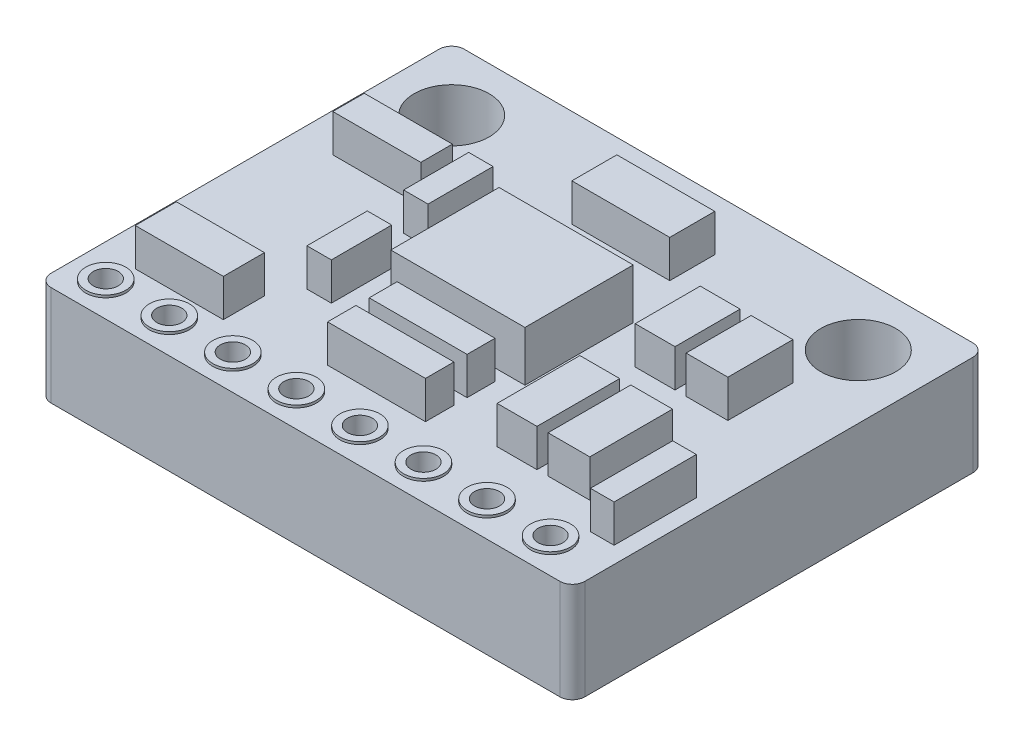
from build123d import *

# Parameters (mm, degrees)
ESBO_O3_W                         = 21.336
ESBO_O3_H                         = 16.51
RESSALTO_EXTRUS_O2_DEPTH          = 4
ESBO_O4_R                         = 1.5
CORTE_EXTRUS_O1_DEPTH             = 4
FILETE1_R                         = 0.5
FILETE2_R                         = 0.5
FILETE3_R                         = 0.5
FILETE4_R                         = 0.5
ESBO_O6_W                         = 5.363320094
ESBO_O6_H                         = 4.328965504
RESSALTO_EXTRUS_O3_DEPTH          = 2
ESBO_O7_W                         = 3.520843833
ESBO_O7_H                         = 1.644177383
ESBO_O7_H_2                       = 1.26172738
ESBO_O7_W_2                       = 3.914121278
ESBO_O7_H_3                       = 1.80047819
ESBO_O7_W_3                       = 1.591796621
ESBO_O7_H_4                       = 2.601533146
ESBO_O7_W_4                       = 1.669839356
ESBO_O7_H_5                       = 3.308391078
ESBO_O7_W_5                       = 0.945688299
ESBO_O7_H_6                       = 3.288354766
ESBO_O7_W_6                       = 0.976018527
ESBO_O7_H_7                       = 2.412779016
ESBO_O7_H_8                       = 1.116603467
ESBO_O7_H_9                       = 1.136639779
RESSALTO_EXTRUS_O4_DEPTH          = 1.5
ESBO_O8_R                         = 0.8
RESSALTO_EXTRUS_O5_DEPTH          = 0.1
CORTE_EXTRUS_O2_REACH             = 16.07
ESBO_O9_R                         = 0.5
CORTE_EXTRUS_O2_DIRECTION_2_REACH = 16.07


with BuildPart() as part:
    # Esboço3 → Ressalto-extrusão2 (new body)
    with BuildSketch(Plane(origin=(0, 0, 0), x_dir=(1, 0, 0), z_dir=(0, 1, 0))):
        Rectangle(ESBO_O3_W, ESBO_O3_H)
    extrude(amount=RESSALTO_EXTRUS_O2_DEPTH)

    # Esboço4 → Corte-extrusão1 (cut)
    with BuildSketch(Plane(origin=(0, 4, 0), x_dir=(1, 0, 0), z_dir=(0, 1, 0))):
        with Locations(Location((-8.128, 5.715, 0), (0, 0, 270))):
            Circle(ESBO_O4_R)
        with Locations(Location((8.128, 5.715, 0), (0, 0, 270))):
            Circle(ESBO_O4_R)
    extrude(amount=-CORTE_EXTRUS_O1_DEPTH, mode=Mode.SUBTRACT)

    # Filete1
    filete1_edges = [part.edges().sort_by_distance(p)[0] for p in [
        (-10.668, 2, -8.255),
    ]]
    fillet(filete1_edges, radius=FILETE1_R)

    # Filete2
    filete2_edges = [part.edges().sort_by_distance(p)[0] for p in [
        (10.668, 2, -8.255),
    ]]
    fillet(filete2_edges, radius=FILETE2_R)

    # Filete3
    filete3_edges = [part.edges().sort_by_distance(p)[0] for p in [
        (-10.668, 2, 8.255),
    ]]
    fillet(filete3_edges, radius=FILETE3_R)

    # Filete4
    filete4_edges = [part.edges().sort_by_distance(p)[0] for p in [
        (10.668, 2, 8.255),
    ]]
    fillet(filete4_edges, radius=FILETE4_R)

    # Esboço6 → Ressalto-extrusão3 (add)
    with BuildSketch(Plane(origin=(0, 4, 0), x_dir=(1, 0, 0), z_dir=(0, 1, 0))):
        Rectangle(ESBO_O6_W, ESBO_O6_H)
    extrude(amount=RESSALTO_EXTRUS_O3_DEPTH)

    # Esboço7 → Ressalto-extrusão4 (add)
    with BuildSketch(Plane(origin=(0, 4, 0), x_dir=(1, 0, 0), z_dir=(0, 1, 0))):
        with Locations((-7.375825986, -5.101929154)):
            Rectangle(ESBO_O7_W, ESBO_O7_H)
        with Locations((-7.375825986, 2.601618051)):
            Rectangle(ESBO_O7_W, ESBO_O7_H_2)
        with Locations((0, 5.249162988)):
            Rectangle(ESBO_O7_W_2, ESBO_O7_H_3)
        with Locations((5.049892828, 1.970754361)):
            Rectangle(ESBO_O7_W_3, ESBO_O7_H_4)
        with Locations((7.123709081, 1.970754361)):
            Rectangle(ESBO_O7_W_4, ESBO_O7_H_4)
        with Locations((5.049892828, -3.193964812)):
            Rectangle(ESBO_O7_W_3, ESBO_O7_H_5)
        with Locations((7.123709081, -3.193964812)):
            Rectangle(ESBO_O7_W_4, ESBO_O7_H_5)
        with Locations((9.532074416, -4.279840462)):
            Rectangle(ESBO_O7_W_5, ESBO_O7_H_6)
        with Locations((-4.515338041, 1.970754361)):
            Rectangle(ESBO_O7_W_6, ESBO_O7_H_4)
        with Locations((-4.515338041, -1.987575304)):
            Rectangle(ESBO_O7_W_6, ESBO_O7_H_7)
        with Locations((0, -3.193964812)):
            Rectangle(ESBO_O7_W_2, ESBO_O7_H_8)
        with Locations((0, -4.848160352)):
            Rectangle(ESBO_O7_W_2, ESBO_O7_H_9)
    extrude(amount=RESSALTO_EXTRUS_O4_DEPTH)

    # Esboço8 → Ressalto-extrusão5 (add)
    with BuildSketch(Plane(origin=(0, 4, 0), x_dir=(1, 0, 0), z_dir=(0, 1, 0))):
        with Locations(Location((-9.285722554, -6.953840931, 0), (0, 0, 270))):
            Circle(ESBO_O8_R)
        with Locations(Location((-6.745722554, -6.953840931, 0), (0, 0, 270))):
            Circle(ESBO_O8_R)
        with Locations(Location((-4.205722554, -6.953840931, 0), (0, 0, 270))):
            Circle(ESBO_O8_R)
        with Locations(Location((-1.665722554, -6.953840931, 0), (0, 0, 270))):
            Circle(ESBO_O8_R)
        with Locations(Location((0.874277446, -6.953840931, 0), (0, 0, 270))):
            Circle(ESBO_O8_R)
        with Locations(Location((3.414277446, -6.953840931, 0), (0, 0, 270))):
            Circle(ESBO_O8_R)
        with Locations(Location((5.954277446, -6.953840931, 0), (0, 0, 270))):
            Circle(ESBO_O8_R)
        with Locations(Location((8.494277446, -6.953840931, 0), (0, 0, 270))):
            Circle(ESBO_O8_R)
    extrude(amount=RESSALTO_EXTRUS_O5_DEPTH)

    # Esboço9 → Corte-extrusão2 (cut, up to next)
    with BuildSketch(Plane(origin=(0, 4, 0), x_dir=(1, 0, 0), z_dir=(0, 1, 0)), mode=Mode.PRIVATE) as corte_extrus_o2_sk1:
        with Locations(Location((-9.285722554, -6.953840931, 0), (0, 0, 270))):
            Circle(ESBO_O9_R)
    corte_extrus_o2_tool1 = extrude(corte_extrus_o2_sk1.sketch, amount=-CORTE_EXTRUS_O2_REACH, mode=Mode.PRIVATE) & part.part
    # Esboço9 → Corte-extrusão2 (cut, up to next)
    with BuildSketch(Plane(origin=(0, 4, 0), x_dir=(1, 0, 0), z_dir=(0, 1, 0)), mode=Mode.PRIVATE) as corte_extrus_o2_sk2:
        with Locations(Location((-6.745722554, -6.953840931, 0), (0, 0, 270))):
            Circle(ESBO_O9_R)
    corte_extrus_o2_tool2 = extrude(corte_extrus_o2_sk2.sketch, amount=-CORTE_EXTRUS_O2_REACH, mode=Mode.PRIVATE) & part.part
    # Esboço9 → Corte-extrusão2 (cut, up to next)
    with BuildSketch(Plane(origin=(0, 4, 0), x_dir=(1, 0, 0), z_dir=(0, 1, 0)), mode=Mode.PRIVATE) as corte_extrus_o2_sk3:
        with Locations(Location((-4.205722554, -6.953840931, 0), (0, 0, 270))):
            Circle(ESBO_O9_R)
    corte_extrus_o2_tool3 = extrude(corte_extrus_o2_sk3.sketch, amount=-CORTE_EXTRUS_O2_REACH, mode=Mode.PRIVATE) & part.part
    # Esboço9 → Corte-extrusão2 (cut, up to next)
    with BuildSketch(Plane(origin=(0, 4, 0), x_dir=(1, 0, 0), z_dir=(0, 1, 0)), mode=Mode.PRIVATE) as corte_extrus_o2_sk4:
        with Locations(Location((-1.665722554, -6.953840931, 0), (0, 0, 270))):
            Circle(ESBO_O9_R)
    corte_extrus_o2_tool4 = extrude(corte_extrus_o2_sk4.sketch, amount=-CORTE_EXTRUS_O2_REACH, mode=Mode.PRIVATE) & part.part
    # Esboço9 → Corte-extrusão2 (cut, up to next)
    with BuildSketch(Plane(origin=(0, 4, 0), x_dir=(1, 0, 0), z_dir=(0, 1, 0)), mode=Mode.PRIVATE) as corte_extrus_o2_sk5:
        with Locations(Location((0.874277446, -6.953840931, 0), (0, 0, 270))):
            Circle(ESBO_O9_R)
    corte_extrus_o2_tool5 = extrude(corte_extrus_o2_sk5.sketch, amount=-CORTE_EXTRUS_O2_REACH, mode=Mode.PRIVATE) & part.part
    # Esboço9 → Corte-extrusão2 (cut, up to next)
    with BuildSketch(Plane(origin=(0, 4, 0), x_dir=(1, 0, 0), z_dir=(0, 1, 0)), mode=Mode.PRIVATE) as corte_extrus_o2_sk6:
        with Locations(Location((3.414277446, -6.953840931, 0), (0, 0, 270))):
            Circle(ESBO_O9_R)
    corte_extrus_o2_tool6 = extrude(corte_extrus_o2_sk6.sketch, amount=-CORTE_EXTRUS_O2_REACH, mode=Mode.PRIVATE) & part.part
    # Esboço9 → Corte-extrusão2 (cut, up to next)
    with BuildSketch(Plane(origin=(0, 4, 0), x_dir=(1, 0, 0), z_dir=(0, 1, 0)), mode=Mode.PRIVATE) as corte_extrus_o2_sk7:
        with Locations(Location((5.954277446, -6.953840931, 0), (0, 0, 270))):
            Circle(ESBO_O9_R)
    corte_extrus_o2_tool7 = extrude(corte_extrus_o2_sk7.sketch, amount=-CORTE_EXTRUS_O2_REACH, mode=Mode.PRIVATE) & part.part
    # Esboço9 → Corte-extrusão2 (cut, up to next)
    with BuildSketch(Plane(origin=(0, 4, 0), x_dir=(1, 0, 0), z_dir=(0, 1, 0)), mode=Mode.PRIVATE) as corte_extrus_o2_sk8:
        with Locations(Location((8.494277446, -6.953840931, 0), (0, 0, 270))):
            Circle(ESBO_O9_R)
    corte_extrus_o2_tool8 = extrude(corte_extrus_o2_sk8.sketch, amount=-CORTE_EXTRUS_O2_REACH, mode=Mode.PRIVATE) & part.part
    add(corte_extrus_o2_tool1.solids().sort_by_distance((-9.285723, 4, 6.953841))[0], mode=Mode.SUBTRACT)
    add(corte_extrus_o2_tool2.solids().sort_by_distance((-6.745723, 4, 6.953841))[0], mode=Mode.SUBTRACT)
    add(corte_extrus_o2_tool3.solids().sort_by_distance((-4.205723, 4, 6.953841))[0], mode=Mode.SUBTRACT)
    add(corte_extrus_o2_tool4.solids().sort_by_distance((-1.665723, 4, 6.953841))[0], mode=Mode.SUBTRACT)
    add(corte_extrus_o2_tool5.solids().sort_by_distance((0.874277, 4, 6.953841))[0], mode=Mode.SUBTRACT)
    add(corte_extrus_o2_tool6.solids().sort_by_distance((3.414277, 4, 6.953841))[0], mode=Mode.SUBTRACT)
    add(corte_extrus_o2_tool7.solids().sort_by_distance((5.954277, 4, 6.953841))[0], mode=Mode.SUBTRACT)
    add(corte_extrus_o2_tool8.solids().sort_by_distance((8.494277, 4, 6.953841))[0], mode=Mode.SUBTRACT)

    # Esboço9 → Corte-extrusão2 direction 2 (cut, up to next)
    with BuildSketch(Plane(origin=(0, 4, 0), x_dir=(1, 0, 0), z_dir=(0, 1, 0)), mode=Mode.PRIVATE) as corte_extrus_o2_direction_2_sk1:
        with Locations(Location((-9.285722554, -6.953840931, 0), (0, 0, 270))):
            Circle(ESBO_O9_R)
    corte_extrus_o2_direction_2_tool1 = extrude(corte_extrus_o2_direction_2_sk1.sketch, amount=CORTE_EXTRUS_O2_DIRECTION_2_REACH, mode=Mode.PRIVATE) & part.part
    # Esboço9 → Corte-extrusão2 direction 2 (cut, up to next)
    with BuildSketch(Plane(origin=(0, 4, 0), x_dir=(1, 0, 0), z_dir=(0, 1, 0)), mode=Mode.PRIVATE) as corte_extrus_o2_direction_2_sk2:
        with Locations(Location((-6.745722554, -6.953840931, 0), (0, 0, 270))):
            Circle(ESBO_O9_R)
    corte_extrus_o2_direction_2_tool2 = extrude(corte_extrus_o2_direction_2_sk2.sketch, amount=CORTE_EXTRUS_O2_DIRECTION_2_REACH, mode=Mode.PRIVATE) & part.part
    # Esboço9 → Corte-extrusão2 direction 2 (cut, up to next)
    with BuildSketch(Plane(origin=(0, 4, 0), x_dir=(1, 0, 0), z_dir=(0, 1, 0)), mode=Mode.PRIVATE) as corte_extrus_o2_direction_2_sk3:
        with Locations(Location((-4.205722554, -6.953840931, 0), (0, 0, 270))):
            Circle(ESBO_O9_R)
    corte_extrus_o2_direction_2_tool3 = extrude(corte_extrus_o2_direction_2_sk3.sketch, amount=CORTE_EXTRUS_O2_DIRECTION_2_REACH, mode=Mode.PRIVATE) & part.part
    # Esboço9 → Corte-extrusão2 direction 2 (cut, up to next)
    with BuildSketch(Plane(origin=(0, 4, 0), x_dir=(1, 0, 0), z_dir=(0, 1, 0)), mode=Mode.PRIVATE) as corte_extrus_o2_direction_2_sk4:
        with Locations(Location((-1.665722554, -6.953840931, 0), (0, 0, 270))):
            Circle(ESBO_O9_R)
    corte_extrus_o2_direction_2_tool4 = extrude(corte_extrus_o2_direction_2_sk4.sketch, amount=CORTE_EXTRUS_O2_DIRECTION_2_REACH, mode=Mode.PRIVATE) & part.part
    # Esboço9 → Corte-extrusão2 direction 2 (cut, up to next)
    with BuildSketch(Plane(origin=(0, 4, 0), x_dir=(1, 0, 0), z_dir=(0, 1, 0)), mode=Mode.PRIVATE) as corte_extrus_o2_direction_2_sk5:
        with Locations(Location((0.874277446, -6.953840931, 0), (0, 0, 270))):
            Circle(ESBO_O9_R)
    corte_extrus_o2_direction_2_tool5 = extrude(corte_extrus_o2_direction_2_sk5.sketch, amount=CORTE_EXTRUS_O2_DIRECTION_2_REACH, mode=Mode.PRIVATE) & part.part
    # Esboço9 → Corte-extrusão2 direction 2 (cut, up to next)
    with BuildSketch(Plane(origin=(0, 4, 0), x_dir=(1, 0, 0), z_dir=(0, 1, 0)), mode=Mode.PRIVATE) as corte_extrus_o2_direction_2_sk6:
        with Locations(Location((3.414277446, -6.953840931, 0), (0, 0, 270))):
            Circle(ESBO_O9_R)
    corte_extrus_o2_direction_2_tool6 = extrude(corte_extrus_o2_direction_2_sk6.sketch, amount=CORTE_EXTRUS_O2_DIRECTION_2_REACH, mode=Mode.PRIVATE) & part.part
    # Esboço9 → Corte-extrusão2 direction 2 (cut, up to next)
    with BuildSketch(Plane(origin=(0, 4, 0), x_dir=(1, 0, 0), z_dir=(0, 1, 0)), mode=Mode.PRIVATE) as corte_extrus_o2_direction_2_sk7:
        with Locations(Location((5.954277446, -6.953840931, 0), (0, 0, 270))):
            Circle(ESBO_O9_R)
    corte_extrus_o2_direction_2_tool7 = extrude(corte_extrus_o2_direction_2_sk7.sketch, amount=CORTE_EXTRUS_O2_DIRECTION_2_REACH, mode=Mode.PRIVATE) & part.part
    # Esboço9 → Corte-extrusão2 direction 2 (cut, up to next)
    with BuildSketch(Plane(origin=(0, 4, 0), x_dir=(1, 0, 0), z_dir=(0, 1, 0)), mode=Mode.PRIVATE) as corte_extrus_o2_direction_2_sk8:
        with Locations(Location((8.494277446, -6.953840931, 0), (0, 0, 270))):
            Circle(ESBO_O9_R)
    corte_extrus_o2_direction_2_tool8 = extrude(corte_extrus_o2_direction_2_sk8.sketch, amount=CORTE_EXTRUS_O2_DIRECTION_2_REACH, mode=Mode.PRIVATE) & part.part
    add(corte_extrus_o2_direction_2_tool1.solids().sort_by_distance((-9.285723, 4, 6.953841))[0], mode=Mode.SUBTRACT)
    add(corte_extrus_o2_direction_2_tool2.solids().sort_by_distance((-6.745723, 4, 6.953841))[0], mode=Mode.SUBTRACT)
    add(corte_extrus_o2_direction_2_tool3.solids().sort_by_distance((-4.205723, 4, 6.953841))[0], mode=Mode.SUBTRACT)
    add(corte_extrus_o2_direction_2_tool4.solids().sort_by_distance((-1.665723, 4, 6.953841))[0], mode=Mode.SUBTRACT)
    add(corte_extrus_o2_direction_2_tool5.solids().sort_by_distance((0.874277, 4, 6.953841))[0], mode=Mode.SUBTRACT)
    add(corte_extrus_o2_direction_2_tool6.solids().sort_by_distance((3.414277, 4, 6.953841))[0], mode=Mode.SUBTRACT)
    add(corte_extrus_o2_direction_2_tool7.solids().sort_by_distance((5.954277, 4, 6.953841))[0], mode=Mode.SUBTRACT)
    add(corte_extrus_o2_direction_2_tool8.solids().sort_by_distance((8.494277, 4, 6.953841))[0], mode=Mode.SUBTRACT)


solid = part.part
